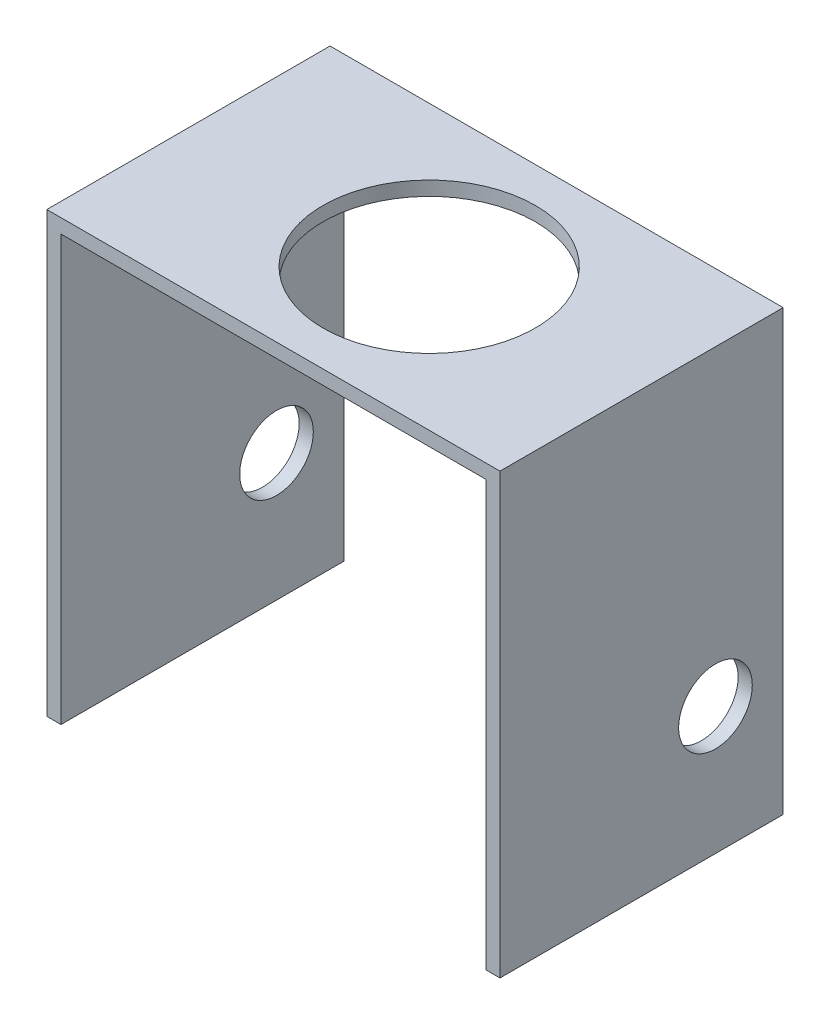
from build123d import *

# Parameters (mm, degrees)
SKETCH10_W          = 1
SKETCH10_H          = 30
BOSS_EXTRUDE1_DEPTH = 20
SKETCH11_R          = 2.6
CUT_EXTRUDE1_DEPTH  = 42.01792231
SKETCH12_R          = 7.5
CUT_EXTRUDE2_DEPTH  = 42.238966794


with BuildPart() as part:
    # Sketch10 → Boss-Extrude1 (new body)
    with BuildSketch(Plane.XY):
        with Locations((-17.929660394, 0.077000672)):
            Rectangle(SKETCH10_W, SKETCH10_H)
        with Locations((13.070339606, 0.077000672)):
            Rectangle(SKETCH10_W, SKETCH10_H)
        Polygon((-18.429660394, 16.077000672), (-18.429660394, 15.077000672), (-17.429660394, 15.077000672), (12.570339606, 15.077000672), (13.570339606, 15.077000672), (13.570339606, 16.077000672), align=None)
    extrude(amount=BOSS_EXTRUDE1_DEPTH)

    # Sketch11 → Cut-Extrude1 (cut, through all)
    with BuildSketch(Plane(origin=(13.570339606, 0, 0), x_dir=(0, 0, -1), z_dir=(1, 0, 0))):
        with Locations((-4.780263521, -5.922999328)):
            Circle(SKETCH11_R)
    extrude(amount=-CUT_EXTRUDE1_DEPTH, mode=Mode.SUBTRACT)

    # Sketch12 → Cut-Extrude2 (cut, through all)
    with BuildSketch(Plane(origin=(0, 16.077000672, 0), x_dir=(1, 0, 0), z_dir=(0, 1, 0))):
        with Locations(Location((-1.429660394, -10, 0), (0, 0, 270))):
            Circle(SKETCH12_R)
    extrude(amount=-CUT_EXTRUDE2_DEPTH, mode=Mode.SUBTRACT)


solid = part.part
